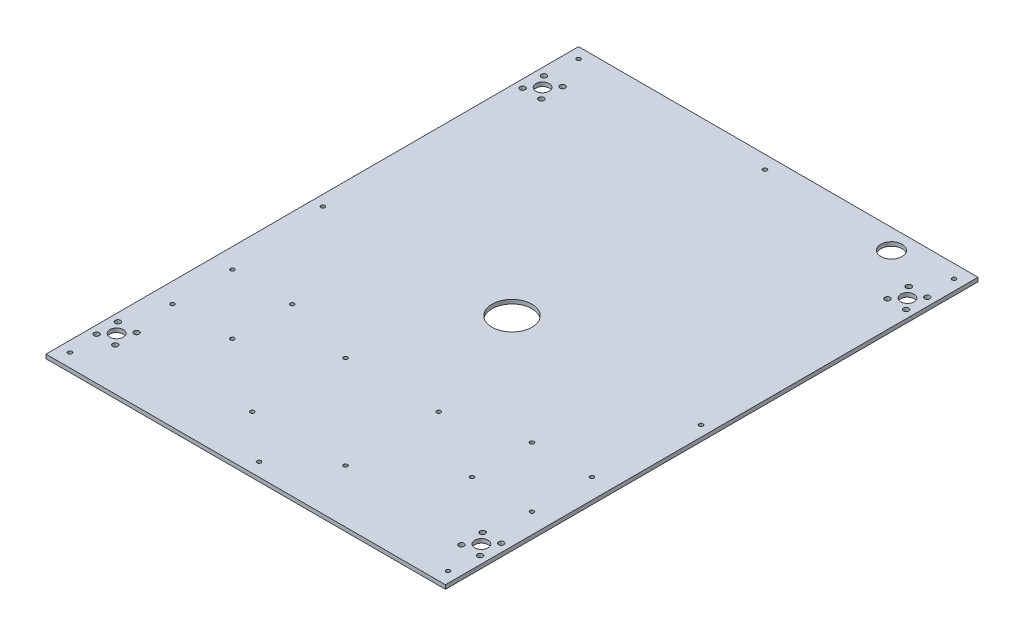
from build123d import *

# Parameters (mm, degrees)
SKETCH_1_W          = 300
SKETCH_1_H          = 400
SKETCH_1_R          = 5
SKETCH_1_R_2        = 2
EXTRUDE_1_DEPTH     = 3
SKETCH_4_R          = 1.5
CUT_EXTRUDE_1_DEPTH = 251.017999352
SKETCH_5_R          = 1.5
CUT_EXTRUDE_2_DEPTH = 10
SKETCH_6_R          = 1.5
CUT_EXTRUDE_3_DEPTH = 251.017999352
SKETCH_7_R          = 15
CUT_EXTRUDE_4_DEPTH = 251.017999352
SKETCH_8_R          = 8
CUT_EXTRUDE_5_DEPTH = 10


with BuildPart() as part:
    # 草图1 → 凸台-拉伸1 (new body)
    with BuildSketch(Plane(origin=(0, 0, 0), x_dir=(1, 0, 0), z_dir=(0, 1, 0))):
        Rectangle(SKETCH_1_W, SKETCH_1_H)
        with Locations(Location((-137, 160, 0), (0, 0, 270))):
            Circle(SKETCH_1_R, mode=Mode.SUBTRACT)
        with Locations(Location((137, 160, 0), (0, 0, 270))):
            Circle(SKETCH_1_R, mode=Mode.SUBTRACT)
        with Locations(Location((137, -160, 0), (0, 0, 270))):
            Circle(SKETCH_1_R, mode=Mode.SUBTRACT)
        with Locations(Location((-137, -160, 0), (0, 0, 270))):
            Circle(SKETCH_1_R, mode=Mode.SUBTRACT)
        with Locations(Location((-144, 168, 0), (0, 0, 270))):
            Circle(SKETCH_1_R_2, mode=Mode.SUBTRACT)
        with Locations(Location((-130, 168, 0), (0, 0, 270))):
            Circle(SKETCH_1_R_2, mode=Mode.SUBTRACT)
        with Locations(Location((-130, 152, 0), (0, 0, 270))):
            Circle(SKETCH_1_R_2, mode=Mode.SUBTRACT)
        with Locations(Location((-144, 152, 0), (0, 0, 270))):
            Circle(SKETCH_1_R_2, mode=Mode.SUBTRACT)
        with Locations(Location((130, 152, 0), (0, 0, 90))):
            Circle(SKETCH_1_R_2, mode=Mode.SUBTRACT)
        with Locations(Location((144, 152, 0), (0, 0, 90))):
            Circle(SKETCH_1_R_2, mode=Mode.SUBTRACT)
        with Locations(Location((130, 168, 0), (0, 0, 90))):
            Circle(SKETCH_1_R_2, mode=Mode.SUBTRACT)
        with Locations(Location((144, 168, 0), (0, 0, 90))):
            Circle(SKETCH_1_R_2, mode=Mode.SUBTRACT)
        with Locations(Location((144, -152, 0), (0, 0, 270))):
            Circle(SKETCH_1_R_2, mode=Mode.SUBTRACT)
        with Locations(Location((130, -152, 0), (0, 0, 270))):
            Circle(SKETCH_1_R_2, mode=Mode.SUBTRACT)
        with Locations(Location((144, -168, 0), (0, 0, 270))):
            Circle(SKETCH_1_R_2, mode=Mode.SUBTRACT)
        with Locations(Location((130, -168, 0), (0, 0, 270))):
            Circle(SKETCH_1_R_2, mode=Mode.SUBTRACT)
        with Locations(Location((-144, -152, 0), (0, 0, 90))):
            Circle(SKETCH_1_R_2, mode=Mode.SUBTRACT)
        with Locations(Location((-130, -152, 0), (0, 0, 90))):
            Circle(SKETCH_1_R_2, mode=Mode.SUBTRACT)
        with Locations(Location((-130, -168, 0), (0, 0, 90))):
            Circle(SKETCH_1_R_2, mode=Mode.SUBTRACT)
        with Locations(Location((-144, -168, 0), (0, 0, 90))):
            Circle(SKETCH_1_R_2, mode=Mode.SUBTRACT)
    extrude(amount=EXTRUDE_1_DEPTH)

    # 草图4 → 切除-拉伸1 (cut, through all)
    with BuildSketch(Plane(origin=(0, 3, 0), x_dir=(1, 0, 0), z_dir=(0, 1, 0))):
        with Locations(Location((-142, -190, 0), (0, 0, 270))):
            Circle(SKETCH_4_R)
        with Locations(Location((142, -190, 0), (0, 0, 270))):
            Circle(SKETCH_4_R)
        with Locations(Location((142, 0, 0), (0, 0, 270))):
            Circle(SKETCH_4_R)
        with Locations(Location((-142, 0, 0), (0, 0, 270))):
            Circle(SKETCH_4_R)
        with Locations(Location((-142, 192, 0), (0, 0, 270))):
            Circle(SKETCH_4_R)
        with Locations(Location((142, 190, 0), (0, 0, 270))):
            Circle(SKETCH_4_R)
        with Locations(Location((0, 190, 0), (0, 0, 270))):
            Circle(SKETCH_4_R)
        with Locations(Location((0, -190, 0), (0, 0, 270))):
            Circle(SKETCH_4_R)
    extrude(amount=-CUT_EXTRUDE_1_DEPTH, mode=Mode.SUBTRACT)

    # 草图5 → 切除-拉伸2 (cut)
    with BuildSketch(Plane.XZ):
        with Locations(Location((-135, 120, 0), (0, 0, 270))):
            Circle(SKETCH_5_R)
        with Locations(Location((-90, 120, 0), (0, 0, 270))):
            Circle(SKETCH_5_R)
        with Locations(Location((-135, 75, 0), (0, 0, 270))):
            Circle(SKETCH_5_R)
        with Locations(Location((-90, 75, 0), (0, 0, 270))):
            Circle(SKETCH_5_R)
        with Locations(Location((90, 75, 0), (0, 0, 90))):
            Circle(SKETCH_5_R)
        with Locations(Location((135, 75, 0), (0, 0, 90))):
            Circle(SKETCH_5_R)
        with Locations(Location((90, 120, 0), (0, 0, 90))):
            Circle(SKETCH_5_R)
        with Locations(Location((135, 120, 0), (0, 0, 90))):
            Circle(SKETCH_5_R)
    extrude(amount=-CUT_EXTRUDE_2_DEPTH, mode=Mode.SUBTRACT)

    # 草图6 → 切除-拉伸3 (cut, through all)
    with BuildSketch(Plane.XZ):
        with Locations(Location((-35, 160, 0), (0, 0, 270))):
            Circle(SKETCH_6_R)
        with Locations(Location((35, 160, 0), (0, 0, 270))):
            Circle(SKETCH_6_R)
        with Locations(Location((-35, 90, 0), (0, 0, 270))):
            Circle(SKETCH_6_R)
        with Locations(Location((35, 90, 0), (0, 0, 270))):
            Circle(SKETCH_6_R)
    extrude(amount=-CUT_EXTRUDE_3_DEPTH, mode=Mode.SUBTRACT)

    # 草图7 → 切除-拉伸4 (cut, through all)
    with BuildSketch(Plane.XZ):
        with Locations(Location((0, 0, 0), (0, 0, 270))):
            Circle(SKETCH_7_R)
    extrude(amount=-CUT_EXTRUDE_4_DEPTH, mode=Mode.SUBTRACT)

    # 草图8 → 切除-拉伸5 (cut)
    with BuildSketch(Plane(origin=(0, 3, 0), x_dir=(1, 0, 0), z_dir=(0, 1, 0))):
        with Locations(Location((100, 185, 0), (0, 0, 270))):
            Circle(SKETCH_8_R)
    extrude(amount=-CUT_EXTRUDE_5_DEPTH, mode=Mode.SUBTRACT)


solid = part.part
